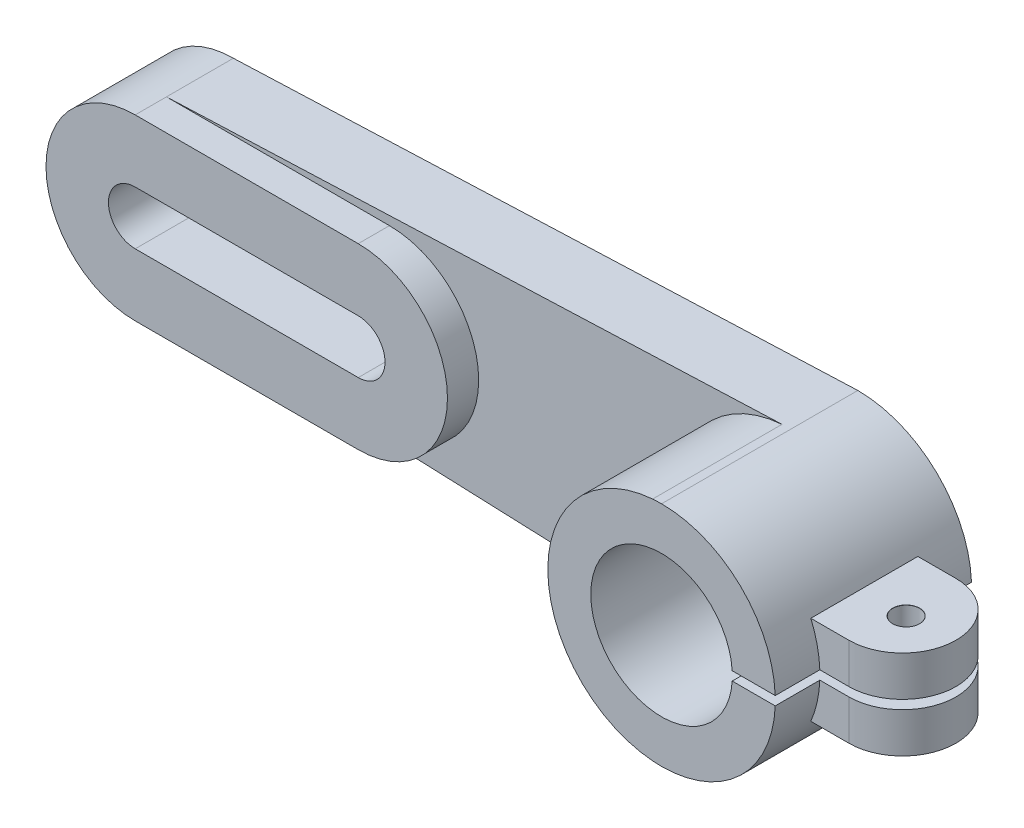
from build123d import *

# Parameters (mm, degrees)
BOSS_EXTRUDE1_DEPTH             = 44
BOSS_EXTRUDE2_DEPTH             = 15
BOSS_EXTRUDE3_DEPTH             = 22
BOSS_EXTRUDE4_START             = 10
BOSS_EXTRUDE4_DEPTH             = 24
FILLET1_RADIUS                  = 12
FILLET1_LENGTH                  = 9
FILLET2_RADIUS                  = 12
FILLET2_LENGTH                  = 9
F_6_0MM_DOWEL_HOLE1_D           = 6
F_6_0MM_DOWEL_HOLE1_CSINK_D     = 6.05
F_6_0MM_DOWEL_HOLE1_CSINK_ANGLE = 90


with BuildPart() as part:
    # Sketch1 → Boss-Extrude1 (new body)
    with BuildSketch(Plane.XY):
        with BuildLine():
            Line((0, 25.5), (-2.000483947, 25.421409559))
            ThreePointArc((-2.000483947, 25.421409559), (-25.5, 0), (-2.000483947, -25.421409559))
            Line((-2.000483947, -25.421409559), (0, -25.5))
            ThreePointArc((0, -25.5), (14.05791592, -21.274985311), (23.457408211, -10))
            ThreePointArc((23.457408211, -10), (24.879246203, -5.592236438), (25.480384612, -1))
            Line((25.480384612, -1), (15.835957699, -1))
            ThreePointArc((15.835957699, -1), (-15.8675, 0), (15.835957699, 1))
            Line((15.835957699, 1), (25.480384612, 1))
            ThreePointArc((25.480384612, 1), (24.879246203, 5.592236438), (23.457408211, 10))
            ThreePointArc((23.457408211, 10), (14.05791592, 21.274985311), (0, 25.5))
        make_face()
    extrude(amount=BOSS_EXTRUDE1_DEPTH)

    # Sketch1<3> → Boss-Extrude2 (add)
    with BuildSketch(Plane.XY):
        with BuildLine():
            Line((-2.000483947, 25.421409559), (-140, 20))
            Line((-140, 20), (-90, 20))
            ThreePointArc((-90, 20), (-70, 0), (-90, -20))
            Line((-90, -20), (-140, -20))
            Line((-140, -20), (-2.000483947, -25.421409559))
            ThreePointArc((-2.000483947, -25.421409559), (-25.5, 0), (-2.000483947, 25.421409559))
        make_face()
    extrude(amount=BOSS_EXTRUDE2_DEPTH)

    # Sketch1<4> → Boss-Extrude3 (add)
    with BuildSketch(Plane.XY):
        with BuildLine():
            Line((-140, -20), (-90, -20))
            ThreePointArc((-90, -20), (-70, 0), (-90, 20))
            Line((-90, 20), (-140, 20))
            ThreePointArc((-140, 20), (-160, 0), (-140, -20))
        make_face()
        with BuildLine():
            ThreePointArc((-140, 6), (-146, 0), (-140, -6))
            Line((-140, -6), (-90, -6))
            ThreePointArc((-90, -6), (-84, 0), (-90, 6))
            Line((-90, 6), (-140, 6))
        make_face(mode=Mode.SUBTRACT)
    extrude(amount=BOSS_EXTRUDE3_DEPTH)

    # Sketch1<5> → Boss-Extrude4 (add)
    with BuildSketch(Plane.XY.offset(BOSS_EXTRUDE4_START)):
        with BuildLine():
            Line((44, 10), (23.457408211, 10))
            ThreePointArc((23.457408211, 10), (24.879246203, 5.592236438), (25.480384612, 1))
            Line((25.480384612, 1), (44, 1))
            Line((44, 1), (44, 10))
        make_face()
        with BuildLine():
            ThreePointArc((25.480384612, -1), (24.879246203, -5.592236438), (23.457408211, -10))
            Line((23.457408211, -10), (44, -10))
            Line((44, -10), (44, -1))
            Line((44, -1), (25.480384612, -1))
        make_face()
    extrude(amount=BOSS_EXTRUDE4_DEPTH)

    # Fillet1: full round fillet: the end face becomes a half cylinder, R = half its width
    fillet1_face = Plane((44, 5.5, 22), x_dir=(0, 1, 0), z_dir=(1, 0, 0))  # on the end face: x along it, z out of the body
    fillet1_slab = fillet1_face.offset(-FILLET1_RADIUS / 2) * Box(FILLET1_LENGTH, 2 * FILLET1_RADIUS, FILLET1_RADIUS, mode=Mode.PRIVATE)  # the body's end, R deep
    fillet1_round = Plane((32, 5.5, 22), x_dir=(1, 0, 0), z_dir=(0, 1, 0)) * Cylinder(FILLET1_RADIUS, FILLET1_LENGTH, mode=Mode.PRIVATE)  # its axis R under the face
    add(fillet1_slab - fillet1_round, mode=Mode.SUBTRACT)

    # Fillet2: full round fillet: the end face becomes a half cylinder, R = half its width
    fillet2_face = Plane((44, -5.5, 22), x_dir=(0, -1, 0), z_dir=(1, 0, 0))  # on the end face: x along it, z out of the body
    fillet2_slab = fillet2_face.offset(-FILLET2_RADIUS / 2) * Box(FILLET2_LENGTH, 2 * FILLET2_RADIUS, FILLET2_RADIUS, mode=Mode.PRIVATE)  # the body's end, R deep
    fillet2_round = Plane((32, -5.5, 22), x_dir=(1, 0, 0), z_dir=(0, -1, 0)) * Cylinder(FILLET2_RADIUS, FILLET2_LENGTH, mode=Mode.PRIVATE)  # its axis R under the face
    add(fillet2_slab - fillet2_round, mode=Mode.SUBTRACT)

    # Ø6.0mm Dowel Hole1 (through all)
    with Locations(Plane(origin=(0, 10, 0), x_dir=(1, 0, 0), z_dir=(0, 1, 0))):
        with Locations((33.693220204, -22.863908444)):
            CounterSinkHole(F_6_0MM_DOWEL_HOLE1_D / 2, F_6_0MM_DOWEL_HOLE1_CSINK_D / 2, counter_sink_angle=F_6_0MM_DOWEL_HOLE1_CSINK_ANGLE)


solid = part.part
